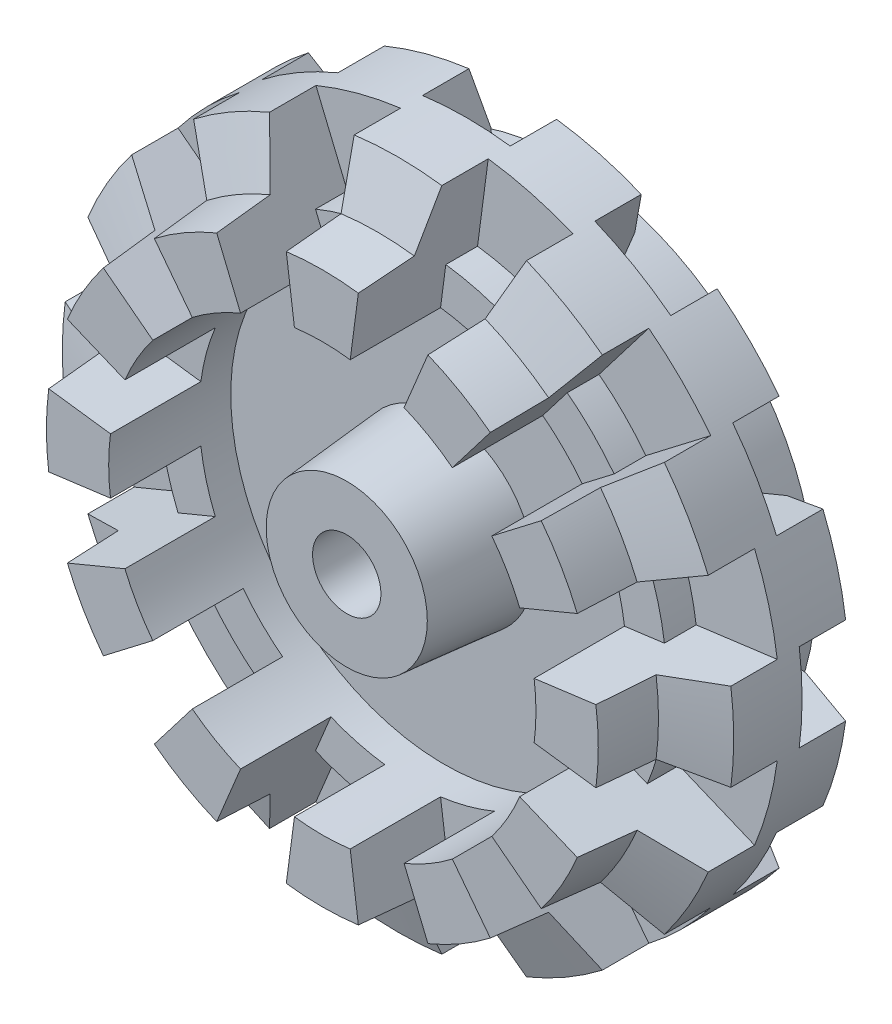
from build123d import *
from build123d.topology import SkipClean

# Parameters (mm, degrees)
SKETCH1_R           = 17.4625
BOSS_EXTRUDE1_DEPTH = 1.143
BOSS_EXTRUDE2_DEPTH = 6.35
SKETCH4_R           = 4.6355
BOSS_EXTRUDE3_DEPTH = 5.08
DRAFT1_ANGLE        = 5
SKETCH5_R           = 4.064
BOSS_EXTRUDE4_DEPTH = 1.27
BOSS_EXTRUDE5_START = 3.175
BOSS_EXTRUDE5_DEPTH = 3.175
BOSS_EXTRUDE6_START = 5.08
SKETCH7_R           = 13.081
SKETCH7_R_2         = 10.414
BOSS_EXTRUDE6_DEPTH = 5.08
SKETCH10_R          = 1.778
CUT_EXTRUDE1_DEPTH  = 28.159448107
SKETCH11_R          = 13.208
SKETCH11_R_2        = 11.1125
BOSS_EXTRUDE7_DEPTH = 1.651


with BuildPart() as part:
    # Sketch1 → Boss-Extrude1 (new body)
    with BuildSketch(Plane.XY):
        Circle(SKETCH1_R)
    extrude(amount=BOSS_EXTRUDE1_DEPTH)

    # Sketch2 → Boss-Extrude2 (add)
    with BuildSketch(Plane.XY.offset(1.143)):
        with BuildLine():
            ThreePointArc((-1.450472311, 11.017431022), (0, 11.1125), (1.450472311, 11.017431022))
            Line((1.450472311, 11.017431022), (2.279313632, 17.313105892))
            ThreePointArc((2.279313632, 17.313105892), (0, 17.4625), (-2.279313632, 17.313105892))
            Line((-2.279313632, 17.313105892), (-1.450472311, 11.017431022))
        make_face()
        with BuildLine():
            ThreePointArc((4.252569642, 10.266611305), (5.55625, 9.6237073), (6.76486138, 8.816138994))
            Line((6.76486138, 8.816138994), (10.630496454, 13.853932705))
            ThreePointArc((10.630496454, 13.853932705), (8.73125, 15.122968614), (6.682609438, 16.133246336))
            Line((6.682609438, 16.133246336), (4.252569642, 10.266611305))
        make_face()
        with BuildLine():
            ThreePointArc((8.816138994, 6.76486138), (9.6237073, 5.55625), (10.266611305, 4.252569642))
            Line((10.266611305, 4.252569642), (16.133246336, 6.682609438))
            ThreePointArc((16.133246336, 6.682609438), (15.122968614, 8.73125), (13.853932705, 10.630496454))
            Line((13.853932705, 10.630496454), (8.816138994, 6.76486138))
        make_face()
        with BuildLine():
            ThreePointArc((11.017431022, 1.450472311), (11.1125, 0), (11.017431022, -1.450472311))
            Line((11.017431022, -1.450472311), (17.313105892, -2.279313632))
            ThreePointArc((17.313105892, -2.279313632), (17.4625, 0), (17.313105892, 2.279313632))
            Line((17.313105892, 2.279313632), (11.017431022, 1.450472311))
        make_face()
        with BuildLine():
            ThreePointArc((10.266611305, -4.252569642), (9.6237073, -5.55625), (8.816138994, -6.76486138))
            Line((8.816138994, -6.76486138), (13.853932705, -10.630496454))
            ThreePointArc((13.853932705, -10.630496454), (15.122968614, -8.73125), (16.133246336, -6.682609438))
            Line((16.133246336, -6.682609438), (10.266611305, -4.252569642))
        make_face()
        with BuildLine():
            ThreePointArc((6.76486138, -8.816138994), (5.55625, -9.6237073), (4.252569642, -10.266611305))
            Line((4.252569642, -10.266611305), (6.682609438, -16.133246336))
            ThreePointArc((6.682609438, -16.133246336), (8.73125, -15.122968614), (10.630496454, -13.853932705))
            Line((10.630496454, -13.853932705), (6.76486138, -8.816138994))
        make_face()
        with BuildLine():
            ThreePointArc((1.450472311, -11.017431022), (0, -11.1125), (-1.450472311, -11.017431022))
            Line((-1.450472311, -11.017431022), (-2.279313632, -17.313105892))
            ThreePointArc((-2.279313632, -17.313105892), (0, -17.4625), (2.279313632, -17.313105892))
            Line((2.279313632, -17.313105892), (1.450472311, -11.017431022))
        make_face()
        with BuildLine():
            ThreePointArc((-4.252569642, -10.266611305), (-5.55625, -9.6237073), (-6.76486138, -8.816138994))
            Line((-6.76486138, -8.816138994), (-10.630496454, -13.853932705))
            ThreePointArc((-10.630496454, -13.853932705), (-8.73125, -15.122968614), (-6.682609438, -16.133246336))
            Line((-6.682609438, -16.133246336), (-4.252569642, -10.266611305))
        make_face()
        with BuildLine():
            ThreePointArc((-8.816138994, -6.76486138), (-9.6237073, -5.55625), (-10.266611305, -4.252569642))
            Line((-10.266611305, -4.252569642), (-16.133246336, -6.682609438))
            ThreePointArc((-16.133246336, -6.682609438), (-15.122968614, -8.73125), (-13.853932705, -10.630496454))
            Line((-13.853932705, -10.630496454), (-8.816138994, -6.76486138))
        make_face()
        with BuildLine():
            ThreePointArc((-11.017431022, -1.450472311), (-11.1125, 0), (-11.017431022, 1.450472311))
            Line((-11.017431022, 1.450472311), (-17.313105892, 2.279313632))
            ThreePointArc((-17.313105892, 2.279313632), (-17.4625, 0), (-17.313105892, -2.279313632))
            Line((-17.313105892, -2.279313632), (-11.017431022, -1.450472311))
        make_face()
        with BuildLine():
            ThreePointArc((-10.266611305, 4.252569642), (-9.6237073, 5.55625), (-8.816138994, 6.76486138))
            Line((-8.816138994, 6.76486138), (-13.853932705, 10.630496454))
            ThreePointArc((-13.853932705, 10.630496454), (-15.122968614, 8.73125), (-16.133246336, 6.682609438))
            Line((-16.133246336, 6.682609438), (-10.266611305, 4.252569642))
        make_face()
        with BuildLine():
            ThreePointArc((-6.76486138, 8.816138994), (-5.55625, 9.6237073), (-4.252569642, 10.266611305))
            Line((-4.252569642, 10.266611305), (-6.682609438, 16.133246336))
            ThreePointArc((-6.682609438, 16.133246336), (-8.73125, 15.122968614), (-10.630496454, 13.853932705))
            Line((-10.630496454, 13.853932705), (-6.76486138, 8.816138994))
        make_face()
    extrude(amount=BOSS_EXTRUDE2_DEPTH)

    # Sketch4 → Boss-Extrude3 (add)
    with BuildSketch(Plane.XY.offset(1.143)):
        Circle(SKETCH4_R)
    extrude(amount=BOSS_EXTRUDE3_DEPTH)

    # Draft1
    draft1_faces = [part.faces().sort_by_distance(p)[0] for p in [
        (-4.6355, 0, 3.683),
    ]]
    draft(draft1_faces, Plane.XY.offset(1.143), DRAFT1_ANGLE)

    # Sketch5 → Boss-Extrude4 (add)
    with BuildSketch(Plane(origin=(0, 0, 0), x_dir=(-1, 0, 0), z_dir=(0, 0, -1))):
        with Locations(Location((0, 0, 0), (0, 0, 180))):
            Circle(SKETCH5_R)
    extrude(amount=BOSS_EXTRUDE4_DEPTH)

    # Sketch6 → Boss-Extrude5 (add)
    with SkipClean():  # the faces are left unmerged after this step: merging them gives an invalid solid
        with BuildSketch(Plane(origin=(0, 0, 0), x_dir=(-1, 0, 0), z_dir=(0, 0, -1)).offset(BOSS_EXTRUDE5_START)):
            with BuildLine():
                Line((-1.359299766, 10.324906786), (-2.279313632, 17.313105892))
                ThreePointArc((-2.279313632, 17.313105892), (-4.519627575, 16.867479742), (-6.682609438, 16.133246336))
                Line((-6.682609438, 16.133246336), (-3.985265265, 9.621281452))
                ThreePointArc((-3.985265265, 9.621281452), (-2.695341536, 10.059151555), (-1.359299766, 10.324906786))
            make_face()
            with BuildLine():
                ThreePointArc((6.682609438, 16.133246336), (4.519627575, 16.867479742), (2.279313632, 17.313105892))
                Line((2.279313632, 17.313105892), (1.359299766, 10.324906786))
                ThreePointArc((1.359299766, 10.324906786), (2.695341536, 10.059151555), (3.985265265, 9.621281452))
                Line((3.985265265, 9.621281452), (6.682609438, 16.133246336))
            make_face()
            with BuildLine():
                ThreePointArc((13.853932705, 10.630496454), (12.347852166, 12.347852166), (10.630496454, 13.853932705))
                Line((10.630496454, 13.853932705), (6.339641522, 8.261981686))
                ThreePointArc((6.339641522, 8.261981686), (7.363810019, 7.363810019), (8.261981686, 6.339641522))
                Line((8.261981686, 6.339641522), (13.853932705, 10.630496454))
            make_face()
            with BuildLine():
                Line((16.133246336, 6.682609438), (9.621281452, 3.985265265))
                ThreePointArc((9.621281452, 3.985265265), (10.059151555, 2.695341536), (10.324906786, 1.359299766))
                Line((10.324906786, 1.359299766), (17.313105892, 2.279313632))
                ThreePointArc((17.313105892, 2.279313632), (16.867479742, 4.519627575), (16.133246336, 6.682609438))
            make_face()
            with BuildLine():
                Line((17.313105892, -2.279313632), (10.324906786, -1.359299766))
                ThreePointArc((10.324906786, -1.359299766), (10.059151555, -2.695341536), (9.621281452, -3.985265265))
                Line((9.621281452, -3.985265265), (16.133246336, -6.682609438))
                ThreePointArc((16.133246336, -6.682609438), (16.867479742, -4.519627575), (17.313105892, -2.279313632))
            make_face()
            with BuildLine():
                Line((13.853932705, -10.630496454), (8.261981686, -6.339641522))
                ThreePointArc((8.261981686, -6.339641522), (7.363810019, -7.363810019), (6.339641522, -8.261981686))
                Line((6.339641522, -8.261981686), (10.630496454, -13.853932705))
                ThreePointArc((10.630496454, -13.853932705), (12.347852166, -12.347852166), (13.853932705, -10.630496454))
            make_face()
            with BuildLine():
                Line((6.682609438, -16.133246336), (3.985265265, -9.621281452))
                ThreePointArc((3.985265265, -9.621281452), (2.695341536, -10.059151555), (1.359299766, -10.324906786))
                Line((1.359299766, -10.324906786), (2.279313632, -17.313105892))
                ThreePointArc((2.279313632, -17.313105892), (4.519627575, -16.867479742), (6.682609438, -16.133246336))
            make_face()
            with BuildLine():
                Line((-2.279313632, -17.313105892), (-1.359299766, -10.324906786))
                ThreePointArc((-1.359299766, -10.324906786), (-2.695341536, -10.059151555), (-3.985265265, -9.621281452))
                Line((-3.985265265, -9.621281452), (-6.682609438, -16.133246336))
                ThreePointArc((-6.682609438, -16.133246336), (-4.519627575, -16.867479742), (-2.279313632, -17.313105892))
            make_face()
            with BuildLine():
                Line((-10.630496454, -13.853932705), (-6.339641522, -8.261981686))
                ThreePointArc((-6.339641522, -8.261981686), (-7.363810019, -7.363810019), (-8.261981686, -6.339641522))
                Line((-8.261981686, -6.339641522), (-13.853932705, -10.630496454))
                ThreePointArc((-13.853932705, -10.630496454), (-12.347852166, -12.347852166), (-10.630496454, -13.853932705))
            make_face()
            with BuildLine():
                Line((-16.133246336, -6.682609438), (-9.621281452, -3.985265265))
                ThreePointArc((-9.621281452, -3.985265265), (-10.059151555, -2.695341536), (-10.324906786, -1.359299766))
                Line((-10.324906786, -1.359299766), (-17.313105892, -2.279313632))
                ThreePointArc((-17.313105892, -2.279313632), (-16.867479742, -4.519627575), (-16.133246336, -6.682609438))
            make_face()
            with BuildLine():
                Line((-17.313105892, 2.279313632), (-10.324906786, 1.359299766))
                ThreePointArc((-10.324906786, 1.359299766), (-10.059151555, 2.695341536), (-9.621281452, 3.985265265))
                Line((-9.621281452, 3.985265265), (-16.133246336, 6.682609438))
                ThreePointArc((-16.133246336, 6.682609438), (-16.867479742, 4.519627575), (-17.313105892, 2.279313632))
            make_face()
            with BuildLine():
                Line((-13.853932705, 10.630496454), (-8.261981686, 6.339641522))
                ThreePointArc((-8.261981686, 6.339641522), (-7.363810019, 7.363810019), (-6.339641522, 8.261981686))
                Line((-6.339641522, 8.261981686), (-10.630496454, 13.853932705))
                ThreePointArc((-10.630496454, 13.853932705), (-12.347852166, 12.347852166), (-13.853932705, 10.630496454))
            make_face()
        extrude(amount=-BOSS_EXTRUDE5_DEPTH)

    # Sketch7 → Boss-Extrude6 (add)
    with SkipClean():  # the faces are left unmerged after this step: merging them gives an invalid solid
        with BuildSketch(Plane(origin=(0, 0, 0), x_dir=(-1, 0, 0), z_dir=(0, 0, -1)).offset(BOSS_EXTRUDE6_START)):
            with Locations(Location((0, 0, 0), (0, 0, 187.5))):
                Circle(SKETCH7_R)
            Circle(SKETCH7_R_2, mode=Mode.SUBTRACT)
        extrude(amount=-BOSS_EXTRUDE6_DEPTH)

    # Sketch9 → Cut-Revolve1 (revolve, cut)
    with SkipClean():  # the faces are left unmerged after this step: merging them gives an invalid solid
        with BuildSketch(Plane(origin=(0, 0, 0), x_dir=(1, 0, 0), z_dir=(0, 1, 0)), mode=Mode.PRIVATE) as cut_revolve1_sk:
            Polygon((17.4625, 2.413), (17.4625, 3.175), (14.605, 3.175), align=None)
            Polygon((14.605, -4.612051731), (17.4625, -4.612051731), (17.4625, -3.556), align=None)
            Polygon((17.4625, -7.493), (14.352949686, -7.493), (14.605, -4.612051731), (17.4625, -4.612051731), align=None)
        revolve(cut_revolve1_sk.sketch.rotate(Axis((0, 0, 0), (0, 0, -1)), 172.5), axis=Axis((0, 0, 0), (0, 0, -1)), mode=Mode.SUBTRACT)

    # Sketch10 → Cut-Extrude1 (cut, through all)
    with SkipClean():  # the faces are left unmerged after this step: merging them gives an invalid solid
        with BuildSketch(Plane.XY.offset(6.223)):
            Circle(SKETCH10_R)
        extrude(amount=-CUT_EXTRUDE1_DEPTH, mode=Mode.SUBTRACT)

    # Sketch11 → Boss-Extrude7 (add)
    with SkipClean():  # the faces are left unmerged after this step: merging them gives an invalid solid
        with BuildSketch(Plane.XY.offset(1.143)):
            Circle(SKETCH11_R)
            with Locations(Location((0, 0, 0), (0, 0, 187.5))):
                Circle(SKETCH11_R_2, mode=Mode.SUBTRACT)
        extrude(amount=BOSS_EXTRUDE7_DEPTH)


solid = part.part
